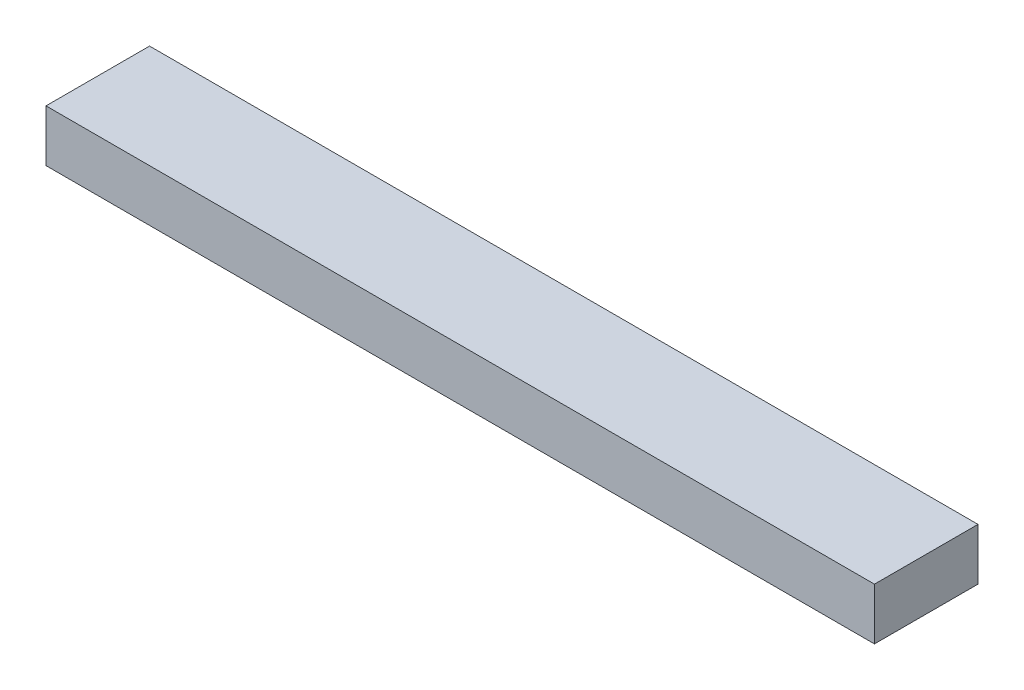
from build123d import *

# Parameters (mm, degrees)
SKETCH1_W           = 800
SKETCH1_H           = 100
BOSS_EXTRUDE1_DEPTH = 50


with BuildPart() as part:
    # Sketch1 → Boss-Extrude1 (new body)
    with BuildSketch(Plane(origin=(0, 0, 0), x_dir=(1, 0, 0), z_dir=(0, 1, 0))):
        with Locations((29.473684211, -81.157894737)):
            Rectangle(SKETCH1_W, SKETCH1_H)
    extrude(amount=BOSS_EXTRUDE1_DEPTH)


solid = part.part
